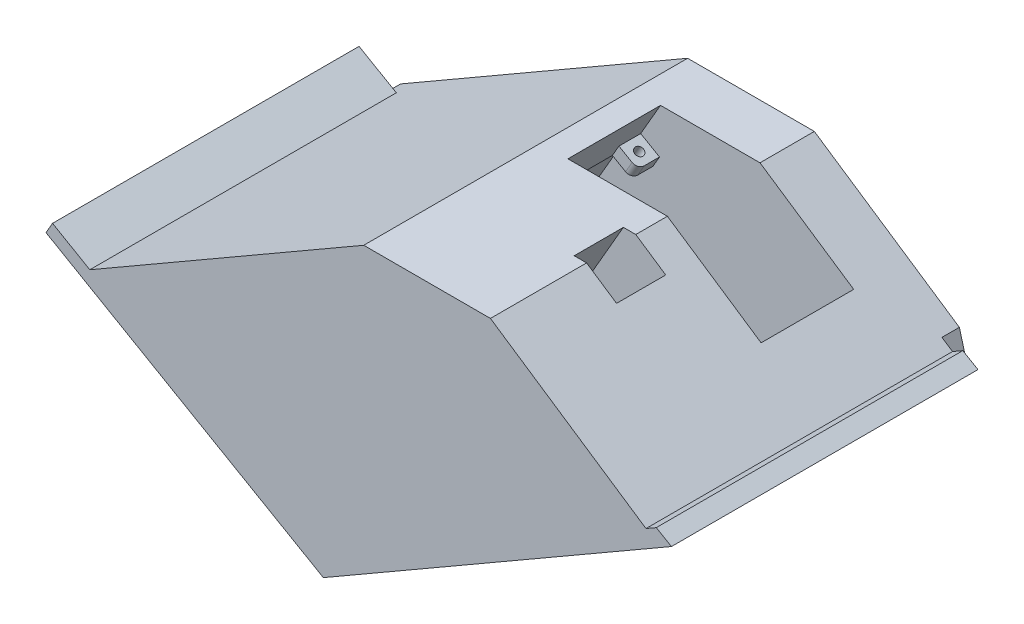
from build123d import *

# Parameters (mm, degrees)
EXTRUDE_1_DEPTH     = 74.5
CUT_EXTRUDE_1_DEPTH = 4
CUT_EXTRUDE_2_DEPTH = 4
CUT_EXTRUDE_3_DEPTH = 62
CUT_EXTRUDE_4_REACH = 124.795
SKETCH_5_W          = 45.7
SKETCH_5_H          = 21.3
SKETCH_6_R          = 0.998844791
SKETCH_6_R_2        = 1.4
EXTRUDE_2_DEPTH     = 3
CUT_EXTRUDE_5_REACH = 124.795
SKETCH_7_W          = 10.739655284
SKETCH_7_H          = 11.312103995
EXTRUDE_3_DEPTH     = 57.007858917
CUT_EXTRUDE_6_DEPTH = 74.5


with BuildPart() as part:
    # 草圖1 → 填料-伸長1 (new body)
    with BuildSketch(Plane.XY):
        Polygon((-93.525975622, -88.048741595), (-102.106102641, -83.095002951), (-103.606102641, -85.693079162), (-97.519536964, -89.207159494), (-39.813710348, -122.523634025), (36.141513372, -78.670865164), (40.257538776, -76.294476789), (36.757538776, -74.273750847), (34.391513372, -75.639776251), (-1.383477376, -51.675674636), (-30.525975622, -51.675674636), align=None)
    extrude(amount=EXTRUDE_1_DEPTH)

    # 草圖2 → 除料-伸長1 (cut)
    with BuildSketch(Plane(origin=(0, 0, 0), x_dir=(-1, 0, 0), z_dir=(0, 0, -1))):
        Polygon((-40.257538776, -76.294476789), (-36.757538776, -74.273750847), (-34.391513372, -75.639776251), (-37.891513372, -77.660502193), align=None)
        Polygon((102.106102641, -83.095002951), (93.525975622, -88.048741595), (96.525975622, -89.780792402), (103.606102641, -85.693079162), align=None)
    extrude(amount=-CUT_EXTRUDE_1_DEPTH, mode=Mode.SUBTRACT)

    # 草圖3 → 除料-伸長2 (cut)
    with BuildSketch(Plane(origin=(0, 0, 0), x_dir=(-1, 0, 0), z_dir=(0, 0, -1))):
        Polygon((-33.635403301, -80.117768489), (-31.970986825, -74.018371384), (-37.891513372, -77.660502193), align=None)
    extrude(amount=-CUT_EXTRUDE_2_DEPTH, mode=Mode.SUBTRACT)

    # 草圖4 → 除料-伸長3 (cut)
    with BuildSketch(Plane.XY.offset(74.5)):
        Polygon((-60.217268861, -110.743634025), (-31.713339402, -61.373379987), (12.19414857, -86.723379987), (7.19414857, -95.383634025), (-39.813710348, -122.523634025), align=None)
    extrude(amount=-CUT_EXTRUDE_3_DEPTH, mode=Mode.SUBTRACT)

    # 草圖5 → 除料-伸長4 (cut, up to next)
    with BuildSketch(Plane(origin=(-34.503787943, -59.762313771, 0), x_dir=(0.8660254037844352, -0.500000000000006, 0), z_dir=(-0.500000000000006, -0.8660254037844352, 0)), mode=Mode.PRIVATE) as cut_extrude_4_sk1:
        with Locations((27.672132433, 23.15)):
            Rectangle(SKETCH_5_W, SKETCH_5_H)
    cut_extrude_4_tool1 = extrude(cut_extrude_4_sk1.sketch, amount=-CUT_EXTRUDE_4_REACH, mode=Mode.PRIVATE) & part.part
    add(cut_extrude_4_tool1.solids().sort_by_distance((-10.539018, -73.59838, 23.15))[0], mode=Mode.SUBTRACT)

    # 草圖6 → 填料-伸長2 (add)
    # profile 1 of 2: a face of its own
    with BuildSketch(Plane(origin=(-34.503787943, -59.762313771, 0), x_dir=(0.8660254037844352, -0.500000000000006, 0), z_dir=(-0.500000000000006, -0.8660254037844352, 0))):
        with BuildLine():
            Line((4.822132433, 17.5), (4.822132433, 12.5))
            Line((4.822132433, 12.5), (9.822132433, 12.5))
            Line((9.822132433, 12.5), (9.822132433, 16))
            ThreePointArc((9.822132433, 16), (9.382792604, 17.060660172), (8.322132433, 17.5))
            Line((8.322132433, 17.5), (4.822132433, 17.5))
        make_face()
        with Locations((7.322132433, 15)):
            Circle(SKETCH_6_R, mode=Mode.SUBTRACT)
    # profile 2 of 2: a face of its own
    with BuildSketch(Plane(origin=(-34.503787943, -59.762313771, 0), x_dir=(0.8660254037844352, -0.500000000000006, 0), z_dir=(-0.500000000000006, -0.8660254037844352, 0))):
        with BuildLine():
            Line((50.522132433, 28.8), (50.522132433, 33.8))
            Line((50.522132433, 33.8), (45.522132433, 33.8))
            Line((45.522132433, 33.8), (45.522132433, 30.299999983))
            ThreePointArc((45.522132433, 30.299999983), (45.961472267, 29.239339822), (47.022132433, 28.8))
            Line((47.022132433, 28.8), (50.522132433, 28.8))
        make_face()
        with Locations((48.022132433, 31.3)):
            Circle(SKETCH_6_R_2, mode=Mode.SUBTRACT)
    extrude(amount=-EXTRUDE_2_DEPTH)

    # 草圖7 → 除料-伸長5 (cut, up to next)
    with BuildSketch(Plane(origin=(-34.503787943, -59.762313771, 0), x_dir=(0.8660254037844352, -0.500000000000006, 0), z_dir=(-0.500000000000006, -0.8660254037844352, 0)), mode=Mode.PRIVATE) as cut_extrude_5_sk1:
        with Locations((27.54107715, 46.72819857)):
            Rectangle(SKETCH_7_W, SKETCH_7_H)
    cut_extrude_5_tool1 = extrude(cut_extrude_5_sk1.sketch, amount=-CUT_EXTRUDE_5_REACH, mode=Mode.PRIVATE) & part.part
    add(cut_extrude_5_tool1.solids().sort_by_distance((-10.652515, -73.532852, 46.728199))[0], mode=Mode.SUBTRACT)

    # 草圖8 → 填料-伸長3 (add)
    with BuildSketch(Plane(origin=(-34.503787943, -59.762313771, 0), x_dir=(0.8660254037844352, -0.500000000000006, 0), z_dir=(-0.500000000000006, -0.8660254037844352, 0))):
        Polygon((22.171249508, 41.072146572), (22.171249508, 52.384250567), (32.910904792, 52.384250567), (32.910904792, 41.072146572), (53.922132433, 41.072146572), (53.922132433, 74.5), (3.222132433, 74.5), (3.222132433, 41.072146572), align=None)
    extrude(amount=EXTRUDE_3_DEPTH)

    # 草圖9 → 除料-伸長6 (cut)
    with BuildSketch(Plane(origin=(0, 0, 0), x_dir=(-1, 0, 0), z_dir=(0, 0, -1))):
        Polygon((39.813710348, -122.523634025), (16.309780889, -136.093634025), (-7.19414857, -95.383634025), align=None)
    extrude(amount=-CUT_EXTRUDE_6_DEPTH, mode=Mode.SUBTRACT)


solid = part.part
